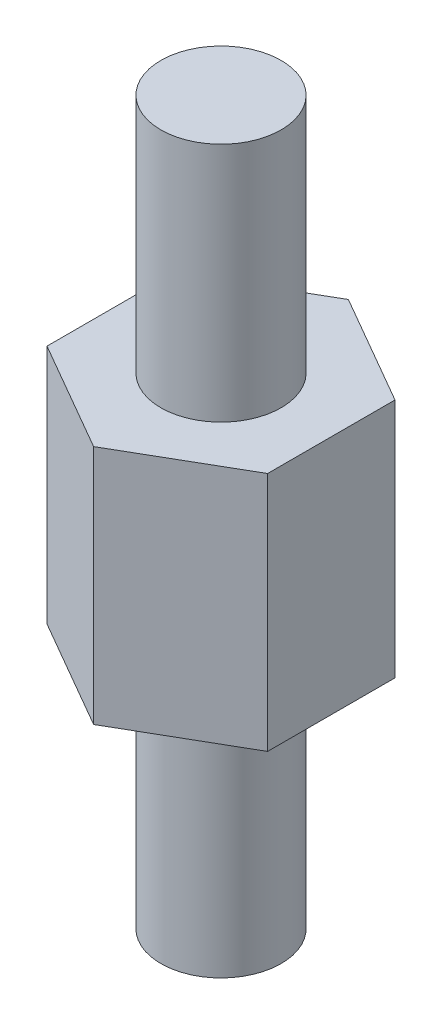
from build123d import *

# Parameters (mm, degrees)
EXTRUDE_1_DEPTH = 6
SKETCH_2_R      = 1.5
EXTRUDE_4_DEPTH = 6
SKETCH_3_R      = 1.5
EXTRUDE_5_DEPTH = 6


with BuildPart() as part:
    # Эскиз1 → Бобышка-Вытянуть1 (new body)
    with BuildSketch(Plane(origin=(0, 0, 0), x_dir=(1, 0, 0), z_dir=(0, 1, 0))):
        Polygon((0, -3.175426481), (2.75, -1.58771324), (2.75, 1.58771324), (0, 3.175426481), (-2.75, 1.58771324), (-2.75, -1.58771324), align=None)
    extrude(amount=EXTRUDE_1_DEPTH)

    # Эскиз3 → Бобышка-Вытянуть5 (add)
    with BuildSketch(Plane.XZ):
        with Locations(Location((0, 0, 0), (0, 0, 90))):
            Circle(SKETCH_3_R)
    extrude(amount=EXTRUDE_5_DEPTH)


with BuildPart() as body_2:
    # Эскиз2 → Бобышка-Вытянуть4 (new body)
    with BuildSketch(Plane(origin=(0, 6, 0), x_dir=(1, 0, 0), z_dir=(0, 1, 0))):
        with Locations(Location((0, 0, 0), (0, 0, 270))):
            Circle(SKETCH_2_R)
    extrude(amount=EXTRUDE_4_DEPTH)


solid = Compound([part.part, body_2.part])
